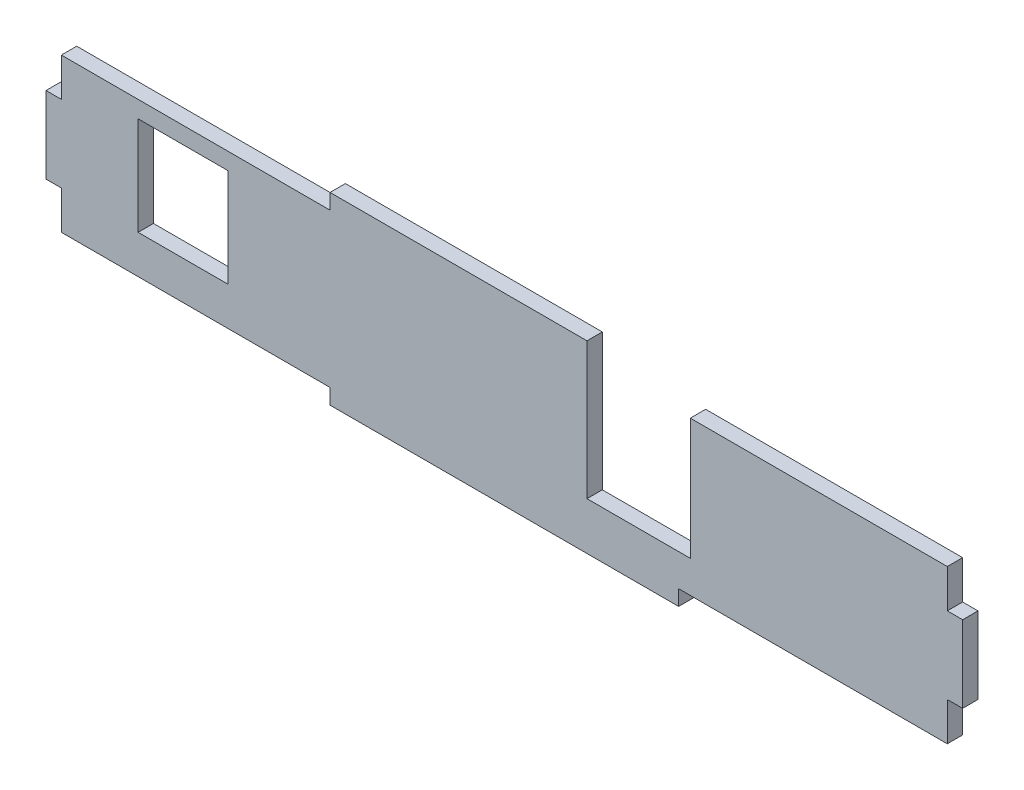
from build123d import *

# Parameters (mm, degrees)
SKETCH1_W           = 11.695168442
SKETCH1_H           = 12.807944464
BOSS_EXTRUDE1_DEPTH = 2


with BuildPart() as part:
    # Sketch1 → Boss-Extrude1 (new body)
    with BuildSketch(Plane.XY):
        Polygon((0, 0), (35, 0), (35, -2.000471596), (80.41, -2.000471596), (80.41, 0), (115.41, 0), (115.41, 5), (117.41, 5), (117.41, 15), (115.409999943, 15), (115.409999943, 20.003619975), (81.929720774, 20.003619975), (81.929720774, 4.189216968), (68.473093168, 4.189216968), (68.473093168, 15.598586388), (68.473093168, 19.951067772), (68.473093168, 22), (35, 22), (35, 20), (0, 20), (0, 15), (-2, 15), (-2, 5), (0, 5), align=None)
        with Locations((15.847584221, 11.403972232)):
            Rectangle(SKETCH1_W, SKETCH1_H, mode=Mode.SUBTRACT)
    extrude(amount=BOSS_EXTRUDE1_DEPTH)


solid = part.part
